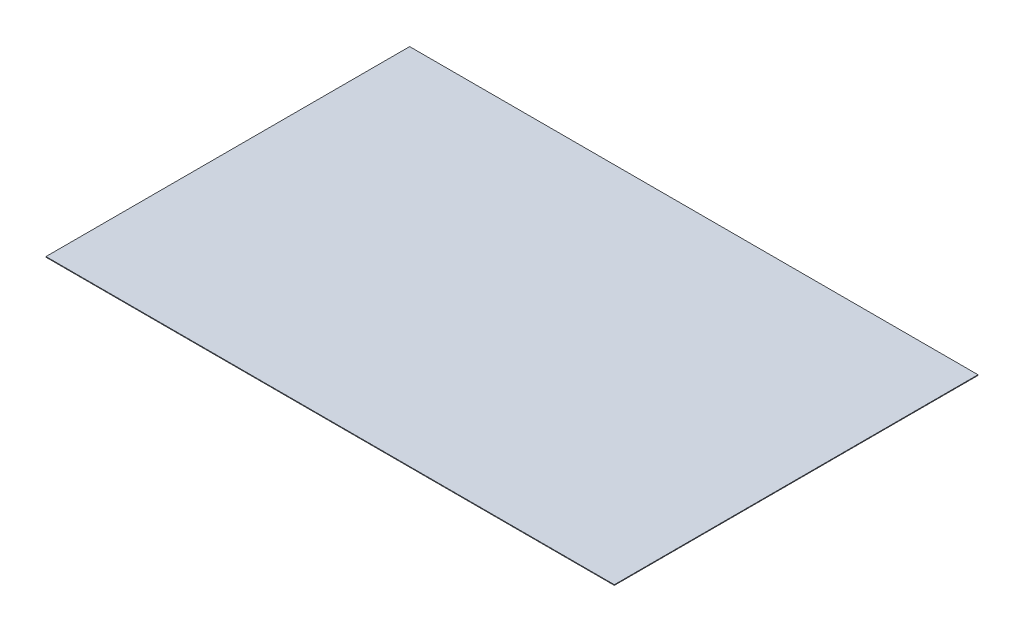
from build123d import *

# Parameters (mm, degrees)
SKETCH1_W           = 8440
SKETCH1_H           = 5400
BOSS_EXTRUDE1_DEPTH = 9.525


with BuildPart() as part:
    # Sketch1 → Boss-Extrude1 (new body)
    with BuildSketch(Plane(origin=(0, 0, 0), x_dir=(1, 0, 0), z_dir=(0, 1, 0))):
        with Locations((-4220, 2700)):
            Rectangle(SKETCH1_W, SKETCH1_H)
    extrude(amount=BOSS_EXTRUDE1_DEPTH)


solid = part.part
